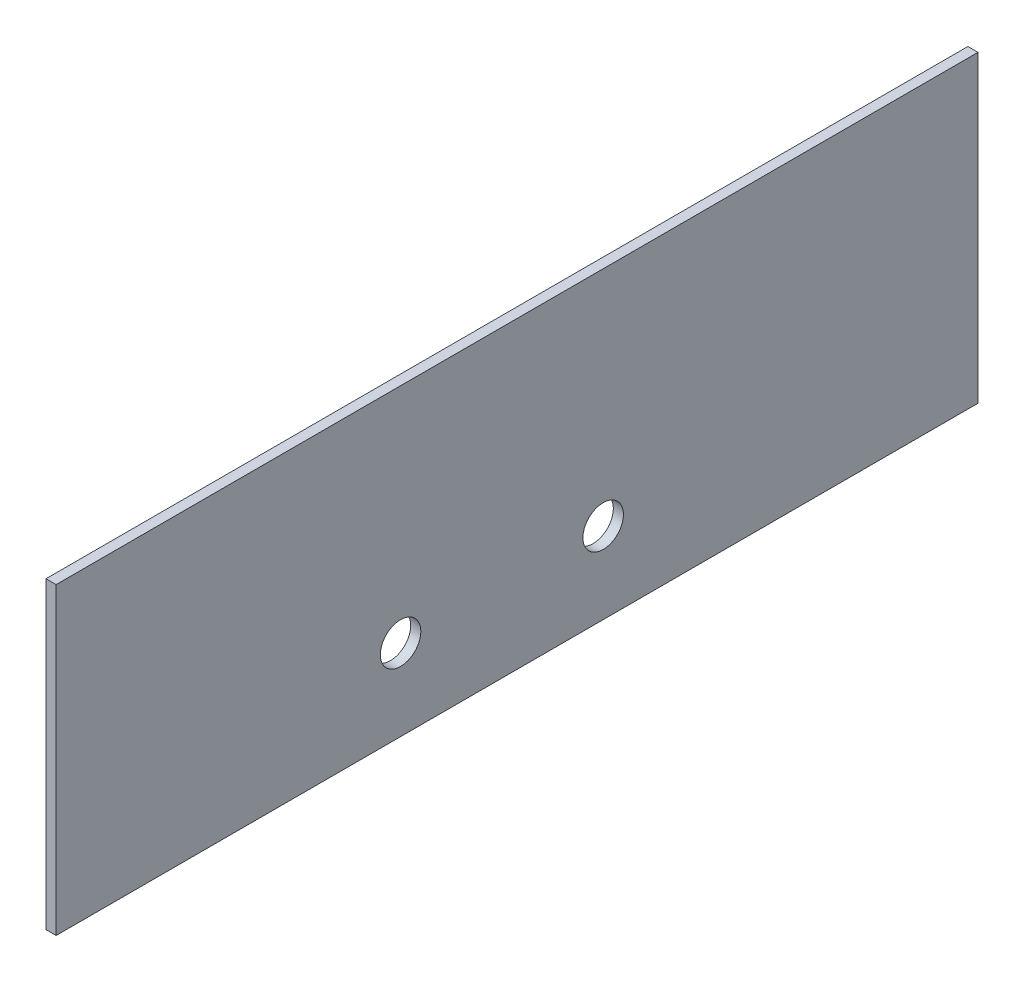
from build123d import *

# Parameters (mm, degrees)
SKETCH2_W             = 182
SKETCH2_H             = 60
BOSS_EXTRUDE1_DEPTH   = 2
F_8_0MM_DOWEL_HOLE2_D = 8


with BuildPart() as part:
    # Sketch2 → Boss-Extrude1 (new body)
    with BuildSketch(Plane.ZY.offset(60)):
        with Locations((89, 30)):
            Rectangle(SKETCH2_W, SKETCH2_H)
    extrude(amount=BOSS_EXTRUDE1_DEPTH)

    # Ø8.0mm Dowel Hole2 (through all)
    with Locations(Plane.ZY.offset(62)):
        with Locations((112, 16), (72, 16)):
            Hole(F_8_0MM_DOWEL_HOLE2_D / 2)


solid = part.part
